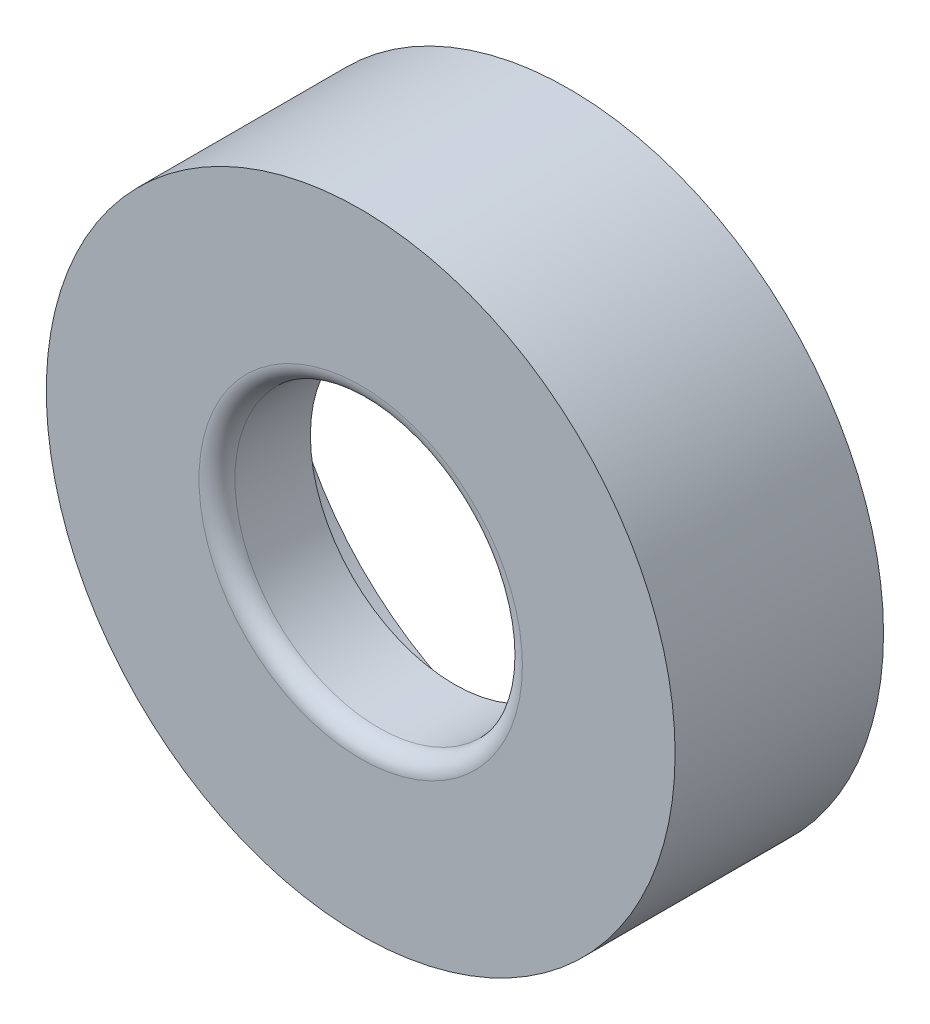
from build123d import *

# Parameters (mm, degrees)
SKETCH1_R           = 8.75
BOSS_EXTRUDE1_DEPTH = 5.8
SKETCH2_R           = 4
CUT_EXTRUDE1_DEPTH  = 95.720711535
SKETCH3_R           = 8.1
CUT_EXTRUDE2_DEPTH  = 3.2
FILLET1_R           = 0.5


with BuildPart() as part:
    # Sketch1 → Boss-Extrude1 (new body)
    with BuildSketch(Plane.XY):
        with Locations((85.206527413, -1.763997815)):
            Circle(SKETCH1_R)
    extrude(amount=BOSS_EXTRUDE1_DEPTH)

    # Sketch2 → Cut-Extrude1 (cut, through all)
    with BuildSketch(Plane.XY.offset(5.8)):
        with Locations((85.206527413, -1.763997815)):
            Circle(SKETCH2_R)
    extrude(amount=-CUT_EXTRUDE1_DEPTH, mode=Mode.SUBTRACT)

    # Sketch3 → Cut-Extrude2 (cut)
    with BuildSketch(Plane(origin=(0, 0, 0), x_dir=(-1, 0, 0), z_dir=(0, 0, -1))):
        with Locations((-85.206527413, -1.763997815)):
            Circle(SKETCH3_R)
    extrude(amount=-CUT_EXTRUDE2_DEPTH, mode=Mode.SUBTRACT)

    # Fillet1
    fillet1_edges = [part.edges().sort_by_distance(p)[0] for p in [
        (81.206527413, -1.763997815, 5.8),
    ]]
    fillet(fillet1_edges, radius=FILLET1_R)


solid = part.part
